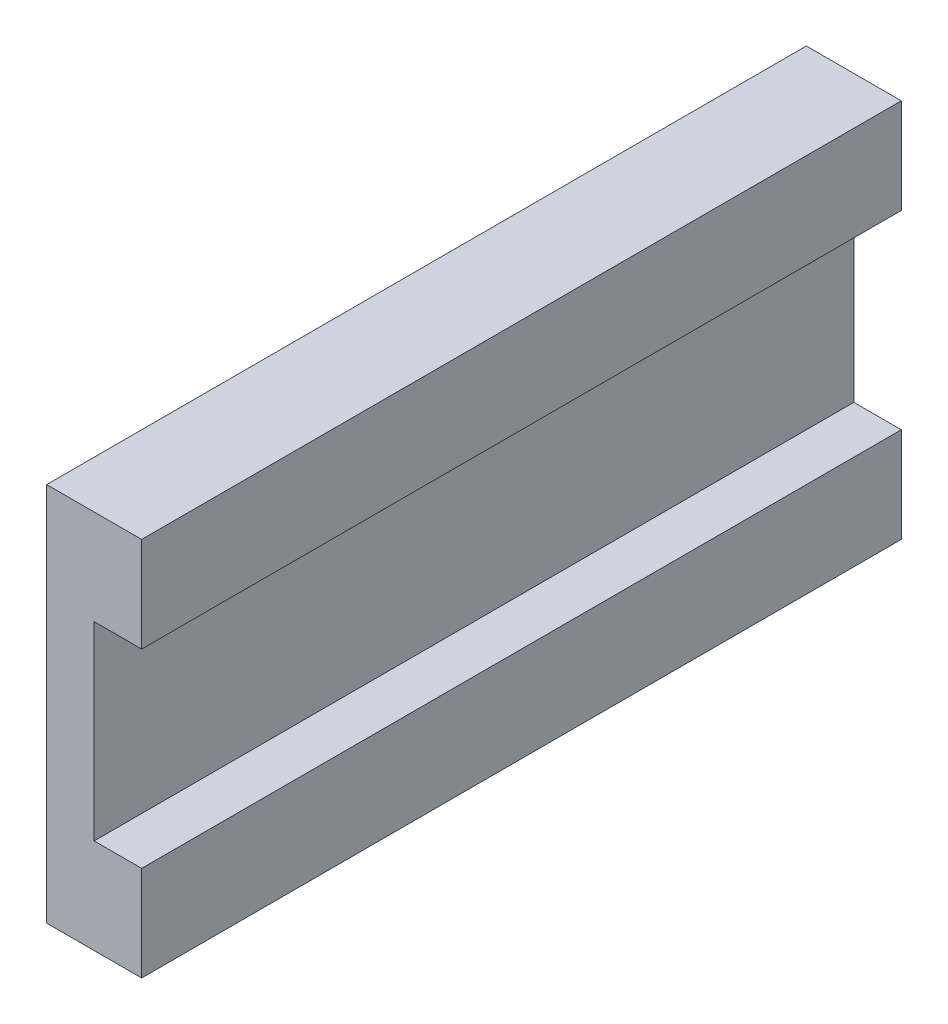
from build123d import *

# Parameters (mm, degrees)
BOSS_EXTRU_1_DEPTH = 80


with BuildPart() as part:
    # Esquisse1 → Boss.-Extru.1 (new, symmetric)
    with BuildSketch(Plane.XY):
        Polygon((0, 0), (0, 80), (20, 80), (20, 60), (10, 60), (10, 20), (20, 20), (20, 0), align=None)
    extrude(amount=BOSS_EXTRU_1_DEPTH, both=True)


solid = part.part
